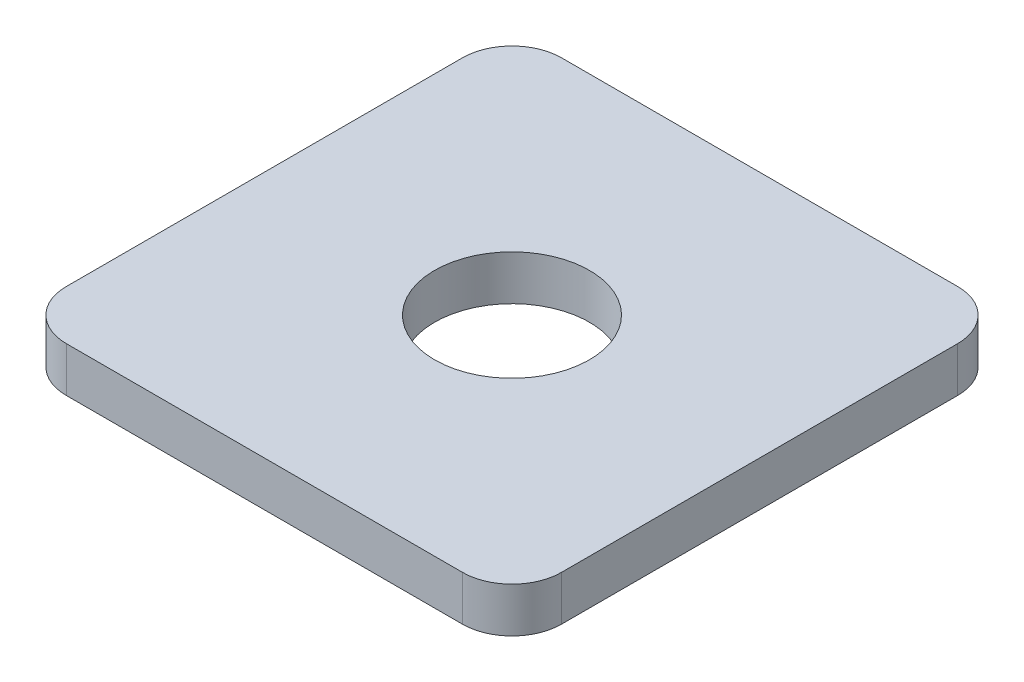
from build123d import *

# Parameters (mm, degrees)
BOSS_EXTRUDE1_DEPTH = 6.35
SKETCH2_R           = 10.95
CUT_EXTRUDE1_DEPTH  = 6.35


with BuildPart() as part:
    # Sketch1 → Boss-Extrude1 (new body)
    with BuildSketch(Plane(origin=(0, 0, 0), x_dir=(1, 0, 0), z_dir=(0, 1, 0))):
        with BuildLine():
            Line((7, 0), (63, 0))
            ThreePointArc((63, 0), (67.949747468, 2.050252532), (70, 7))
            Line((70, 7), (70, 63))
            ThreePointArc((70, 63), (67.949747468, 67.949747468), (63, 70))
            Line((63, 70), (7, 70))
            ThreePointArc((7, 70), (2.050252532, 67.949747468), (0, 63))
            Line((0, 63), (0, 7))
            ThreePointArc((0, 7), (2.050252532, 2.050252532), (7, 0))
        make_face()
    extrude(amount=BOSS_EXTRUDE1_DEPTH)

    # Sketch2 → Cut-Extrude1 (cut)
    with BuildSketch(Plane(origin=(0, 6.35, 0), x_dir=(1, 0, 0), z_dir=(0, 1, 0))):
        with Locations(Location((35, 35, 0), (0, 0, 270))):
            Circle(SKETCH2_R)
    extrude(amount=-CUT_EXTRUDE1_DEPTH, mode=Mode.SUBTRACT)


solid = part.part
